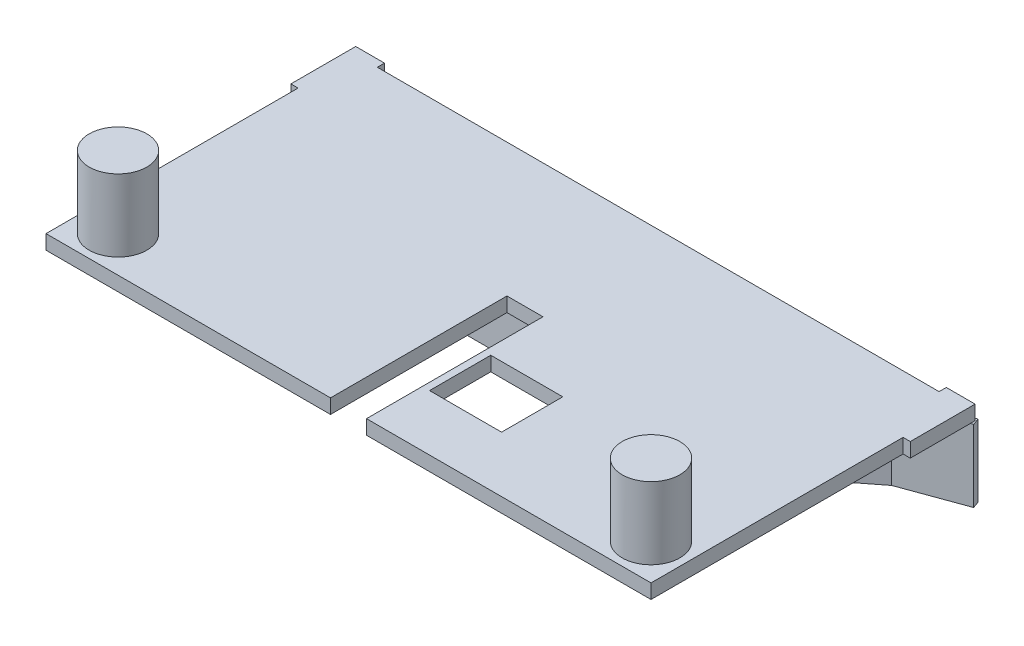
from build123d import *

# Parameters (mm, degrees)
SKETCH1_W           = 546.1
SKETCH1_H           = 279.4
BOSS_EXTRUDE1_DEPTH = 6.35
SKETCH2_W           = 31.75
SKETCH2_H           = 155.575
SKETCH2_W_2         = 6.35
SKETCH2_H_2         = 222.25
SKETCH2_W_3         = 63.5
SKETCH2_H_3         = 53.975
SKETCH2_W_4         = 495.3
SKETCH2_H_4         = 6.35
CUT_EXTRUDE1_DEPTH  = 307.975051918
EXTRUDE2_DEPTH      = 63.5
SKETCH4_R           = 25.4
BOSS_EXTRUDE2_DEPTH = 63.5


with BuildPart() as part:
    # Sketch1 → Boss-Extrude1 (new, symmetric)
    with BuildSketch(Plane(origin=(0, 0, 0), x_dir=(1, 0, 0), z_dir=(0, 1, 0))):
        Rectangle(SKETCH1_W, SKETCH1_H)
    extrude(amount=BOSS_EXTRUDE1_DEPTH, both=True)

    # Sketch2 → Cut-Extrude1 (cut, through all)
    with BuildSketch(Plane(origin=(0, 6.35, 0), x_dir=(1, 0, 0), z_dir=(0, 1, 0))):
        with Locations((0, -61.9125)):
            Rectangle(SKETCH2_W, SKETCH2_H)
        with Locations((-269.875, -28.575)):
            Rectangle(SKETCH2_W_2, SKETCH2_H_2)
        with Locations((53.975, -63.5)):
            Rectangle(SKETCH2_W_3, SKETCH2_H_3)
        with Locations((0, 136.525)):
            Rectangle(SKETCH2_W_4, SKETCH2_H_4)
        with Locations((269.875, -28.575)):
            Rectangle(SKETCH2_W_2, SKETCH2_H_2)
    extrude(amount=-CUT_EXTRUDE1_DEPTH, mode=Mode.SUBTRACT)

    # Sketch3 → Extrude2 (add)
    with BuildSketch(Plane.XZ.offset(6.35)):
        Polygon((222.25, -116.992783244), (129.182460015, -44.45), (-129.182460015, -44.45), (-222.25, -116.992783244), (-275.22182791, -136.272951858), (-273.05, -142.24), (-219.136547039, -122.617107896), (-127, -50.8), (127, -50.8), (219.136547039, -122.617107896), (273.05, -142.24), (275.22182791, -136.272951858), align=None)
    extrude(amount=EXTRUDE2_DEPTH)

    # Sketch4 → Boss-Extrude2 (add)
    with BuildSketch(Plane(origin=(0, 6.35, 0), x_dir=(1, 0, 0), z_dir=(0, 1, 0))):
        with Locations(Location((234.95, -107.95, 0), (0, 0, 90))):
            Circle(SKETCH4_R)
        with Locations(Location((-234.95, -107.95, 0), (0, 0, 90))):
            Circle(SKETCH4_R)
    extrude(amount=BOSS_EXTRUDE2_DEPTH)


solid = part.part
